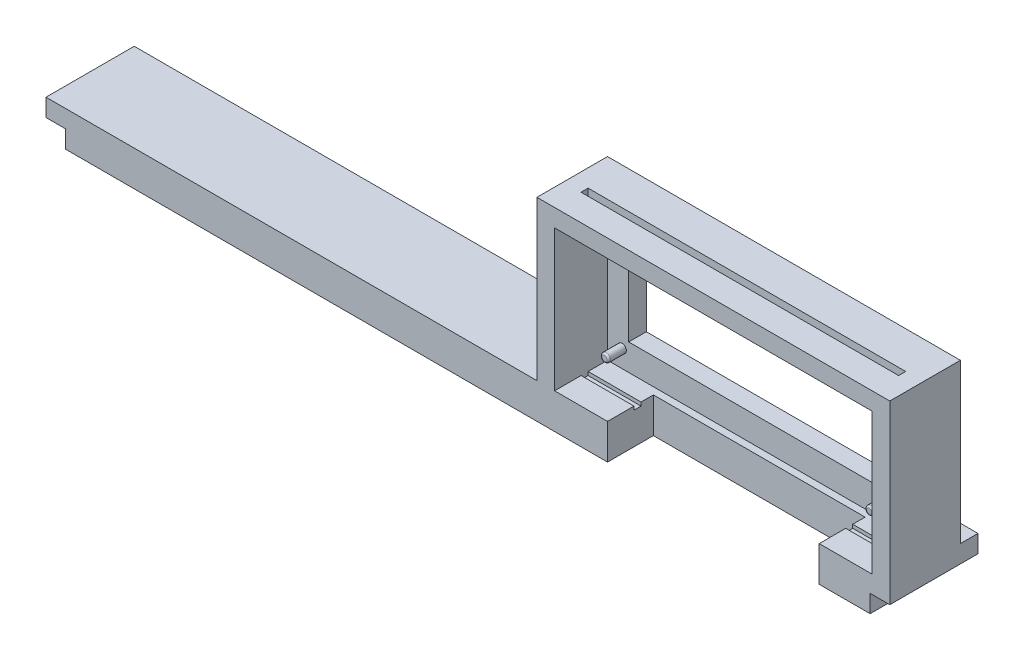
from build123d import *

# Parameters (mm, degrees)
SKETCH2_W           = 100
SKETCH2_H           = 50
BOSS_EXTRUDE1_DEPTH = 20
SHELL1_T            = -5
SKETCH5_W           = 72
SKETCH5_H           = 25
CUT_EXTRUDE1_DEPTH  = 77.995878023
SKETCH6_R           = 1.8
CUT_EXTRUDE2_DEPTH  = 77.995878023
SKETCH7_W           = 6
SKETCH7_H           = 8
CUT_EXTRUDE3_DEPTH  = 4
SKETCH8_W           = 239.14
SKETCH8_H           = 25
BOSS_EXTRUDE2_DEPTH = 5
SKETCH9_W           = 228
SKETCH9_H           = 19
BOSS_EXTRUDE3_DEPTH = 5
SKETCH10_W          = 60
SKETCH10_H          = 13
CUT_EXTRUDE4_DEPTH  = 19
SKETCH11_R          = 1.2
BOSS_EXTRUDE4_DEPTH = 5
SKETCH12_R          = 1.2
BOSS_EXTRUDE5_DEPTH = 5
SKETCH13_R          = 1.2
BOSS_EXTRUDE6_DEPTH = 5
SKETCH14_R          = 1.2
BOSS_EXTRUDE7_DEPTH = 5
FILLET3_R           = 0.5
FILLET4_R           = 0.5
FILLET5_R           = 0.5
FILLET6_R           = 0.5
SKETCH16_W          = 15
SKETCH16_H          = 2
CUT_EXTRUDE5_DEPTH  = 1
SKETCH17_W          = 90
SKETCH17_H          = 2
CUT_EXTRUDE6_DEPTH  = 205.903131616


with BuildPart() as part:
    # Sketch2 → Boss-Extrude1 (new body)
    with BuildSketch(Plane.XY):
        with Locations((-8.560008462, -20.815833959)):
            Rectangle(SKETCH2_W, SKETCH2_H)
    extrude(amount=BOSS_EXTRUDE1_DEPTH)

    # Shell1
    shell1_openings = [part.faces().sort_by_distance(p)[0] for p in [
        (-8.560008462, -20.815833959, 20),
    ]]
    offset(amount=SHELL1_T, openings=shell1_openings, kind=Kind.INTERSECTION)

    # Sketch5 → Cut-Extrude1 (cut, through all)
    with BuildSketch(Plane(origin=(0, 0, 0), x_dir=(-1, 0, 0), z_dir=(0, 0, -1))):
        with Locations((11.560008462, -20.815833959)):
            Rectangle(SKETCH5_W, SKETCH5_H)
    extrude(amount=-CUT_EXTRUDE1_DEPTH, mode=Mode.SUBTRACT)

    # Sketch6 → Cut-Extrude2 (cut, through all)
    with BuildSketch(Plane(origin=(0, 0, 0), x_dir=(-1, 0, 0), z_dir=(0, 0, -1))):
        with Locations((-32.939991538, -20.815833959)):
            Circle(SKETCH6_R)
    extrude(amount=-CUT_EXTRUDE2_DEPTH, mode=Mode.SUBTRACT)

    # Sketch7 → Cut-Extrude3 (cut)
    with BuildSketch(Plane.XY.offset(5)):
        with Locations((32.939991538, -20.815833959)):
            Rectangle(SKETCH7_W, SKETCH7_H)
    extrude(amount=-CUT_EXTRUDE3_DEPTH, mode=Mode.SUBTRACT)

    # Sketch8 → Boss-Extrude2 (add)
    with BuildSketch(Plane.XZ.offset(45.815833959)):
        with Locations((-78.130008462, 7.5)):
            Rectangle(SKETCH8_W, SKETCH8_H)
    extrude(amount=-BOSS_EXTRUDE2_DEPTH)

    # Sketch9 → Boss-Extrude3 (add)
    with BuildSketch(Plane.XZ.offset(45.815833959)):
        with Locations((-78.130008462, 10.5)):
            Rectangle(SKETCH9_W, SKETCH9_H)
    extrude(amount=BOSS_EXTRUDE3_DEPTH)

    # Sketch10 → Cut-Extrude4 (cut)
    with BuildSketch(Plane(origin=(0, -40.815833959, 0), x_dir=(1, 0, 0), z_dir=(0, 1, 0))):
        with Locations((-8.560008462, -13.5)):
            Rectangle(SKETCH10_W, SKETCH10_H)
    extrude(amount=-CUT_EXTRUDE4_DEPTH, mode=Mode.SUBTRACT)

    # Sketch11 → Boss-Extrude4 (add)
    with BuildSketch(Plane.XY.offset(5)):
        with Locations((-49.420008462, -4.775833959)):
            Circle(SKETCH11_R)
    extrude(amount=BOSS_EXTRUDE4_DEPTH)

    # Sketch12 → Boss-Extrude5 (add)
    with BuildSketch(Plane.XY.offset(5)):
        with Locations((25.579991538, -4.775833959)):
            Circle(SKETCH12_R)
    extrude(amount=BOSS_EXTRUDE5_DEPTH)

    # Sketch13 → Boss-Extrude6 (add)
    with BuildSketch(Plane.XY.offset(5)):
        with Locations((-49.420008462, -35.775833959)):
            Circle(SKETCH13_R)
    extrude(amount=BOSS_EXTRUDE6_DEPTH)

    # Sketch14 → Boss-Extrude7 (add)
    with BuildSketch(Plane.XY.offset(5)):
        with Locations((25.579991538, -35.775833959)):
            Circle(SKETCH14_R)
    extrude(amount=BOSS_EXTRUDE7_DEPTH)

    # Fillet3
    fillet3_edges = [part.edges().sort_by_distance(p)[0] for p in [
        (-50.620008462, -35.775833959, 10),
    ]]
    fillet(fillet3_edges, radius=FILLET3_R)

    # Fillet4
    fillet4_edges = [part.edges().sort_by_distance(p)[0] for p in [
        (-50.620008462, -4.775833959, 10),
    ]]
    fillet(fillet4_edges, radius=FILLET4_R)

    # Fillet5
    fillet5_edges = [part.edges().sort_by_distance(p)[0] for p in [
        (24.379991538, -4.775833959, 10),
    ]]
    fillet(fillet5_edges, radius=FILLET5_R)

    # Fillet6
    fillet6_edges = [part.edges().sort_by_distance(p)[0] for p in [
        (24.379991538, -35.775833959, 10),
    ]]
    fillet(fillet6_edges, radius=FILLET6_R)

    # Sketch16 → Cut-Extrude5 (cut)
    with BuildSketch(Plane(origin=(0, -40.815833959, 0), x_dir=(1, 0, 0), z_dir=(0, 1, 0))):
        with Locations((-46.060008462, -11.5)):
            Rectangle(SKETCH16_W, SKETCH16_H)
        with Locations((28.939991538, -11.5)):
            Rectangle(SKETCH16_W, SKETCH16_H)
    extrude(amount=-CUT_EXTRUDE5_DEPTH, mode=Mode.SUBTRACT)

    # Sketch17 → Cut-Extrude6 (cut, through all)
    with BuildSketch(Plane.XZ.offset(0.815833959)):
        with Locations((-8.560008462, 11.5)):
            Rectangle(SKETCH17_W, SKETCH17_H)
    extrude(amount=-CUT_EXTRUDE6_DEPTH, mode=Mode.SUBTRACT)


solid = part.part
